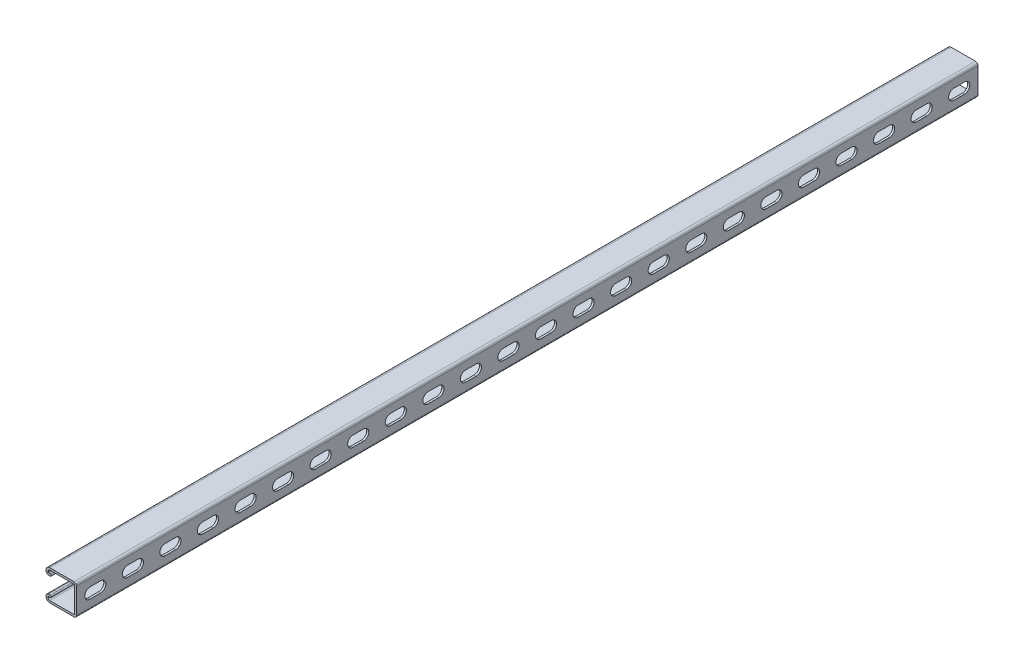
from build123d import *

# Parameters (mm, degrees)
BOSS_EXTRUDE1_DEPTH = 1219.2
CUT_EXTRUDE1_DEPTH  = 2.794
LPATTERN1_COUNT     = 24
LPATTERN1_PITCH     = 50.8


with BuildPart() as part:
    # Sketch1 → Boss-Extrude1 (new body)
    with BuildSketch(Plane.XY):
        with BuildLine():
            Line((-36.22675, 20.6375), (-3.46075, 20.6375))
            ThreePointArc((-3.46075, 20.6375), (-1.013630207, 19.623869793), (0, 17.17675))
            Line((0, 17.17675), (0, -17.17675))
            ThreePointArc((0, -17.17675), (-1.013630207, -19.623869793), (-3.46075, -20.6375))
            Line((-3.46075, -20.6375), (-36.22675, -20.6375))
            ThreePointArc((-36.22675, -20.6375), (-39.796401808, -19.158901808), (-41.275, -15.58925))
            Line((-41.275, -15.58925), (-41.275, -14.57325))
            ThreePointArc((-41.275, -14.57325), (-40.261369793, -12.126130207), (-37.81425, -11.1125))
            Line((-37.81425, -11.1125), (-35.5346, -11.1125))
            ThreePointArc((-35.5346, -11.1125), (-34.1376, -12.5095), (-35.5346, -13.9065))
            Line((-35.5346, -13.9065), (-37.81425, -13.9065))
            ThreePointArc((-37.81425, -13.9065), (-38.285713446, -14.101786554), (-38.481, -14.57325))
            Line((-38.481, -14.57325), (-38.481, -15.58925))
            ThreePointArc((-38.481, -15.58925), (-37.820745461, -17.183245461), (-36.22675, -17.8435))
            Line((-36.22675, -17.8435), (-3.46075, -17.8435))
            ThreePointArc((-3.46075, -17.8435), (-2.989286554, -17.648213446), (-2.794, -17.17675))
            Line((-2.794, -17.17675), (-2.794, 17.17675))
            ThreePointArc((-2.794, 17.17675), (-2.989286554, 17.648213446), (-3.46075, 17.8435))
            Line((-3.46075, 17.8435), (-36.22675, 17.8435))
            ThreePointArc((-36.22675, 17.8435), (-37.820745461, 17.183245461), (-38.481, 15.58925))
            Line((-38.481, 15.58925), (-38.481, 14.57325))
            ThreePointArc((-38.481, 14.57325), (-38.285713446, 14.101786554), (-37.81425, 13.9065))
            Line((-37.81425, 13.9065), (-35.5346, 13.9065))
            ThreePointArc((-35.5346, 13.9065), (-34.1376, 12.5095), (-35.5346, 11.1125))
            Line((-35.5346, 11.1125), (-37.81425, 11.1125))
            ThreePointArc((-37.81425, 11.1125), (-40.261369793, 12.126130207), (-41.275, 14.57325))
            Line((-41.275, 14.57325), (-41.275, 15.58925))
            ThreePointArc((-41.275, 15.58925), (-39.796401808, 19.158901808), (-36.22675, 20.6375))
        make_face()
    extrude(amount=-BOSS_EXTRUDE1_DEPTH)

    # Sketch2 → Cut-Extrude1 (cut)
    with BuildSketch(Plane(origin=(0, 0, 0), x_dir=(0, 0, -1), z_dir=(1, 0, 0))):
        with BuildLine():
            Line((18.25625, 7.14375), (32.54375, 7.14375))
            ThreePointArc((32.54375, 7.14375), (39.6875, 0), (32.54375, -7.14375))
            Line((32.54375, -7.14375), (18.25625, -7.14375))
            ThreePointArc((18.25625, -7.14375), (11.1125, 0), (18.25625, 7.14375))
        make_face()
    cut_extrude1 = extrude(amount=-CUT_EXTRUDE1_DEPTH, mode=Mode.SUBTRACT)

    # LPattern1: Cut-Extrude1 ×24
    with Locations(*[(0, 0, -i * LPATTERN1_PITCH) for i in range(1, LPATTERN1_COUNT)]):
        add(cut_extrude1, mode=Mode.SUBTRACT)


solid = part.part
